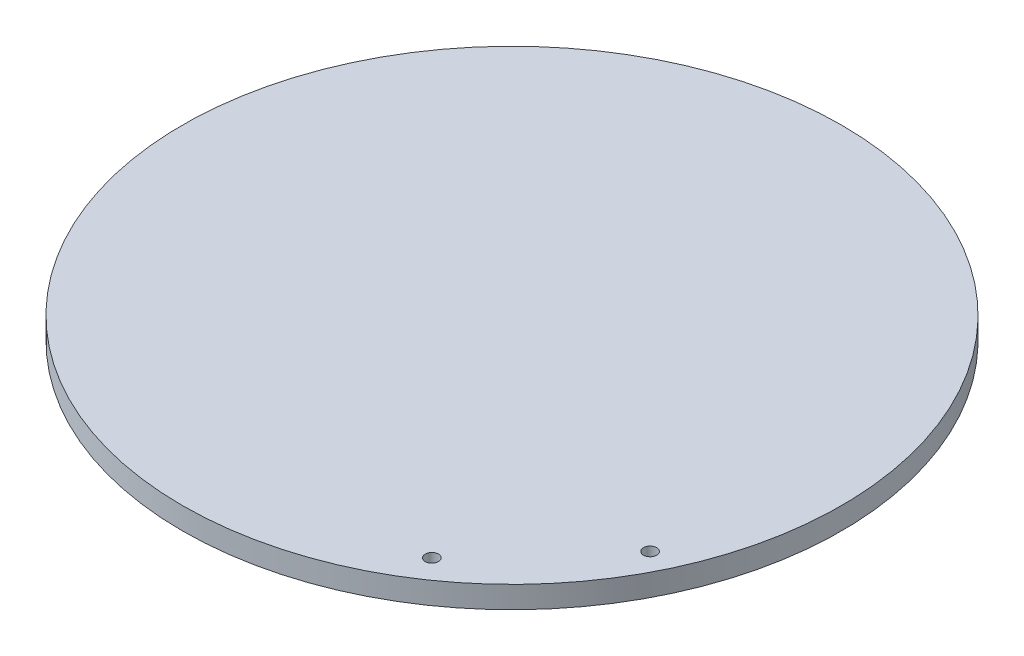
from build123d import *

# Parameters (mm, degrees)
SKETCH1_R           = 150
BOSS_EXTRUDE1_DEPTH = 10
SKETCH5_R           = 3
CUT_EXTRUDE1_DEPTH  = 213.367605816


with BuildPart() as part:
    # Sketch1 → Boss-Extrude1 (new body)
    with BuildSketch(Plane(origin=(0, 0, 0), x_dir=(1, 0, 0), z_dir=(0, 1, 0))):
        with Locations(Location((0, 0, 0), (0, 0, 270))):
            Circle(SKETCH1_R)
    extrude(amount=BOSS_EXTRUDE1_DEPTH)

    # Sketch5 → Cut-Extrude1 (cut, through all)
    with BuildSketch(Plane(origin=(0, 10, 0), x_dir=(1, 0, 0), z_dir=(0, 1, 0))):
        with Locations(Location((77.359391723, -113.82881925, 0), (0, 0, 270))):
            Circle(SKETCH5_R)
        with Locations(Location((124.487218521, -61.651582438, 0), (0, 0, 270))):
            Circle(SKETCH5_R)
    extrude(amount=-CUT_EXTRUDE1_DEPTH, mode=Mode.SUBTRACT)


solid = part.part
